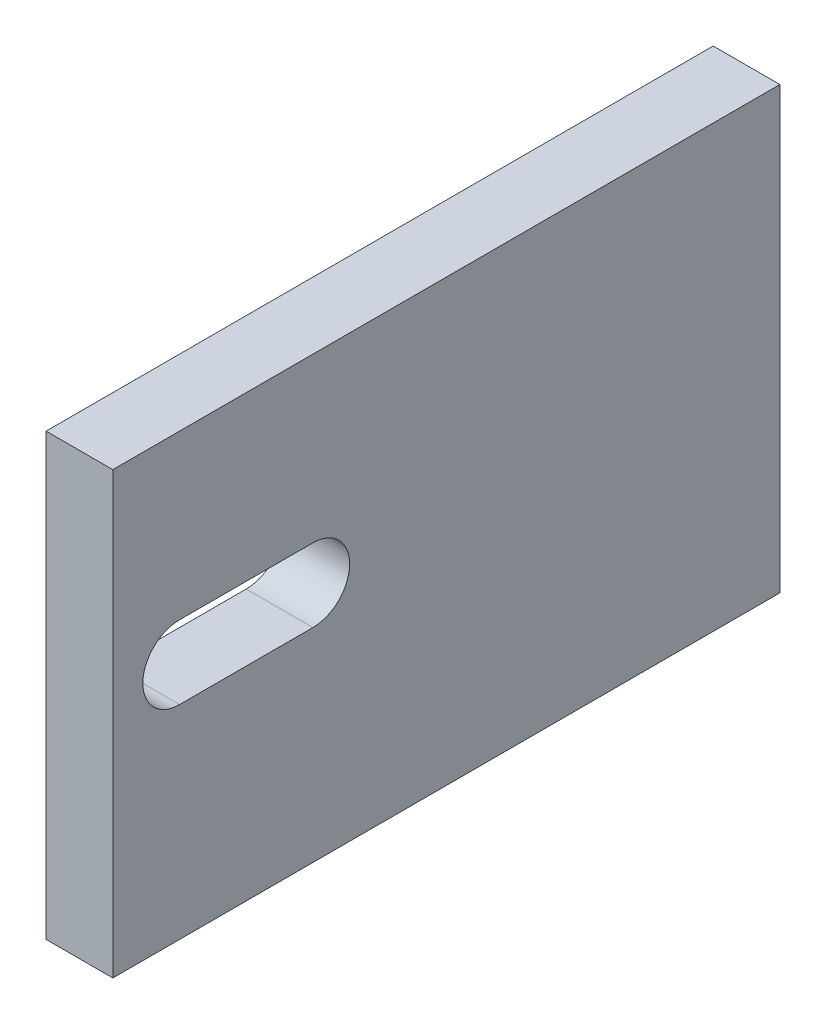
from build123d import *

# Parameters (mm, degrees)
SKETCH1_W      = 50
SKETCH1_H      = 33
EXTRUDE1_DEPTH = 5


with BuildPart() as part:
    # Sketch1 → Extrude1 (new body)
    with BuildSketch(Plane(origin=(0, 0, 0), x_dir=(0, 0, -1), z_dir=(1, 0, 0))):
        Rectangle(SKETCH1_W, SKETCH1_H)
        with BuildLine():
            Line((-20, 4.25), (-10, 4.25))
            ThreePointArc((-10, 4.25), (-7.25, 1.5), (-10, -1.25))
            Line((-10, -1.25), (-20, -1.25))
            ThreePointArc((-20, -1.25), (-22.75, 1.5), (-20, 4.25))
        make_face(mode=Mode.SUBTRACT)
    extrude(amount=EXTRUDE1_DEPTH)


solid = part.part
